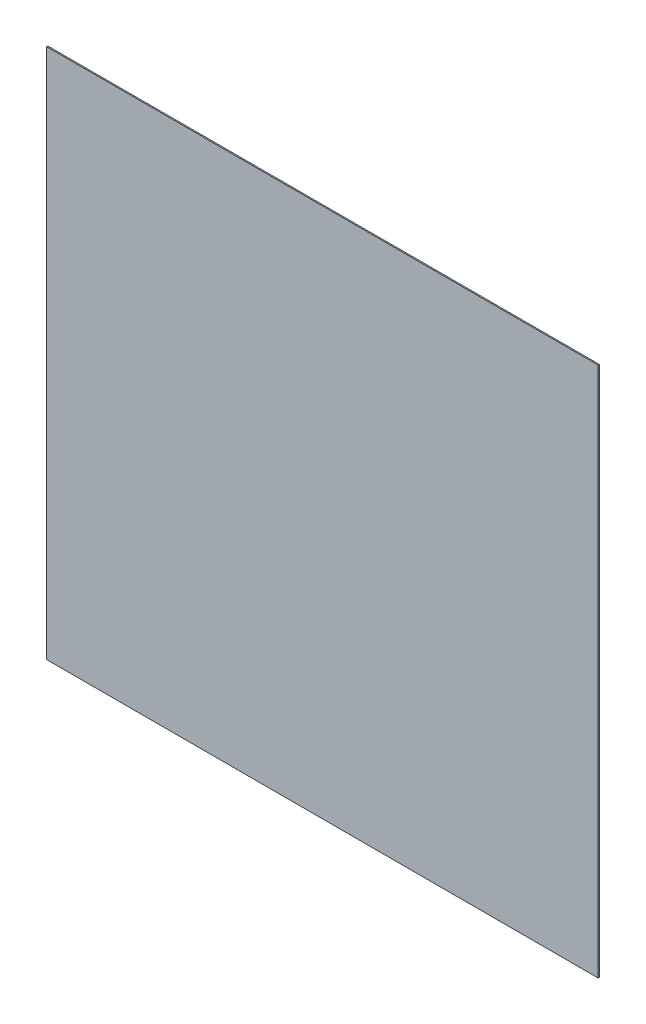
from build123d import *

# Parameters (mm, degrees)
SKETCH1_W           = 935
SKETCH1_H           = 900
BOSS_EXTRUDE1_DEPTH = 2


with BuildPart() as part:
    # Sketch1 → Boss-Extrude1 (new body)
    with BuildSketch(Plane.XY):
        with Locations((467.5, 450)):
            Rectangle(SKETCH1_W, SKETCH1_H)
    extrude(amount=BOSS_EXTRUDE1_DEPTH)


solid = part.part
